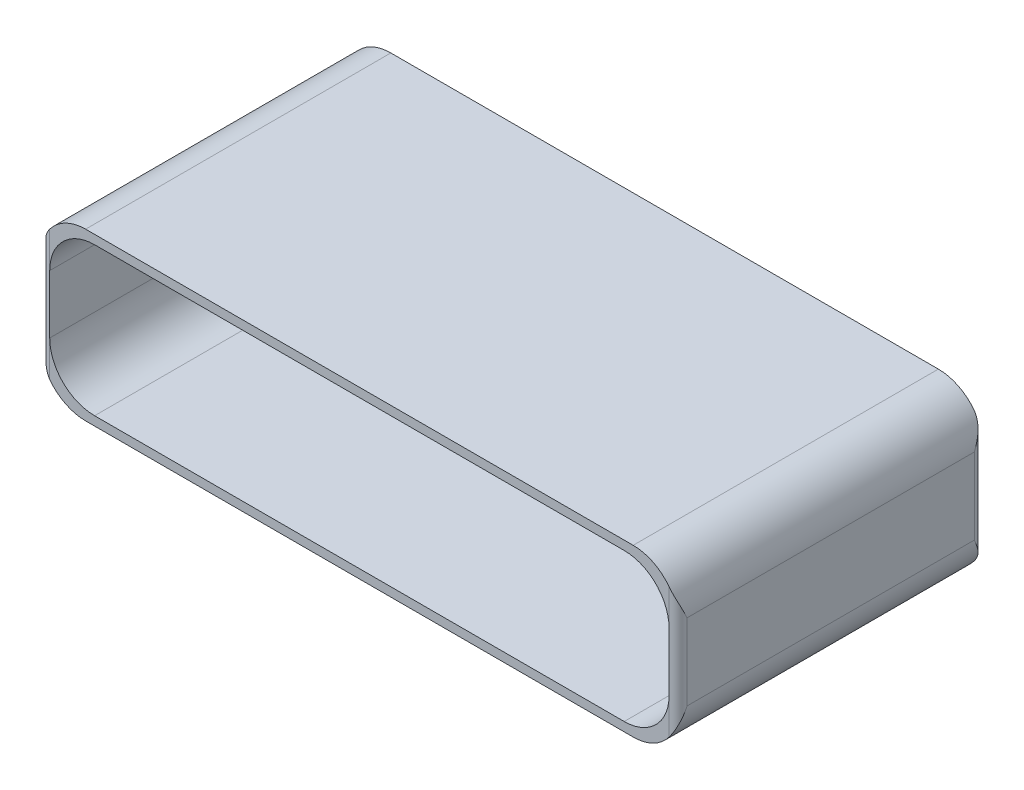
from build123d import *

# Parameters (mm, degrees)
BOSS_EXTRUDE3_DEPTH = 34
CUT_EXTRUDE4_DEPTH  = 17


with BuildPart() as part:
    # Sketch12 → Boss-Extrude3 (new body)
    with BuildSketch(Plane.XY):
        with BuildLine():
            Line((30.5, -9.25), (-30.5, -9.25))
            ThreePointArc((-30.5, -9.25), (-34.035533906, -7.785533906), (-35.5, -4.25))
            Line((-35.5, -4.25), (-35.5, 4.25))
            ThreePointArc((-35.5, 4.25), (-34.035533906, 7.785533906), (-30.5, 9.25))
            Line((-30.5, 9.25), (30.5, 9.25))
            ThreePointArc((30.5, 9.25), (34.035533906, 7.785533906), (35.5, 4.25))
            Line((35.5, 4.25), (35.5, -4.25))
            ThreePointArc((35.5, -4.25), (34.035533906, -7.785533906), (30.5, -9.25))
        make_face()
        with BuildLine():
            Line((29.5, -8.25), (-29.5, -8.25))
            ThreePointArc((-29.5, -8.25), (-33.035533906, -6.785533906), (-34.5, -3.25))
            Line((-34.5, -3.25), (-34.5, 3.25))
            ThreePointArc((-34.5, 3.25), (-33.035533906, 6.785533906), (-29.5, 8.25))
            Line((-29.5, 8.25), (29.5, 8.25))
            ThreePointArc((29.5, 8.25), (33.035533906, 6.785533906), (34.5, 3.25))
            Line((34.5, 3.25), (34.5, -3.25))
            ThreePointArc((34.5, -3.25), (33.035533906, -6.785533906), (29.5, -8.25))
        make_face(mode=Mode.SUBTRACT)
    extrude(amount=BOSS_EXTRUDE3_DEPTH)

    # Sketch14 → Cut-Extrude4 (cut, symmetric)
    with BuildSketch(Plane(origin=(0, 0, 0), x_dir=(1, 0, 0), z_dir=(0, 1, 0))):
        with BuildLine():
            ThreePointArc((-34.5, 0), (-35.207106781, -0.292893219), (-35.5, -1))
            Line((-35.5, -1), (-35.5, 0))
            Line((-35.5, 0), (-34.5, 0))
        make_face()
        with BuildLine():
            Line((34.5, 0), (35.5, 0))
            Line((35.5, 0), (35.5, -1))
            ThreePointArc((35.5, -1), (35.207106781, -0.292893219), (34.5, 0))
        make_face()
        with BuildLine():
            ThreePointArc((34.5, -34), (35.207106781, -33.707106781), (35.5, -33))
            Line((35.5, -33), (35.5, -34))
            Line((35.5, -34), (34.5, -34))
        make_face()
        with BuildLine():
            ThreePointArc((-35.5, -33), (-35.207106781, -33.707106781), (-34.5, -34))
            Line((-34.5, -34), (-35.5, -34))
            Line((-35.5, -34), (-35.5, -33))
        make_face()
    extrude(amount=CUT_EXTRUDE4_DEPTH, both=True, mode=Mode.SUBTRACT)


solid = part.part
